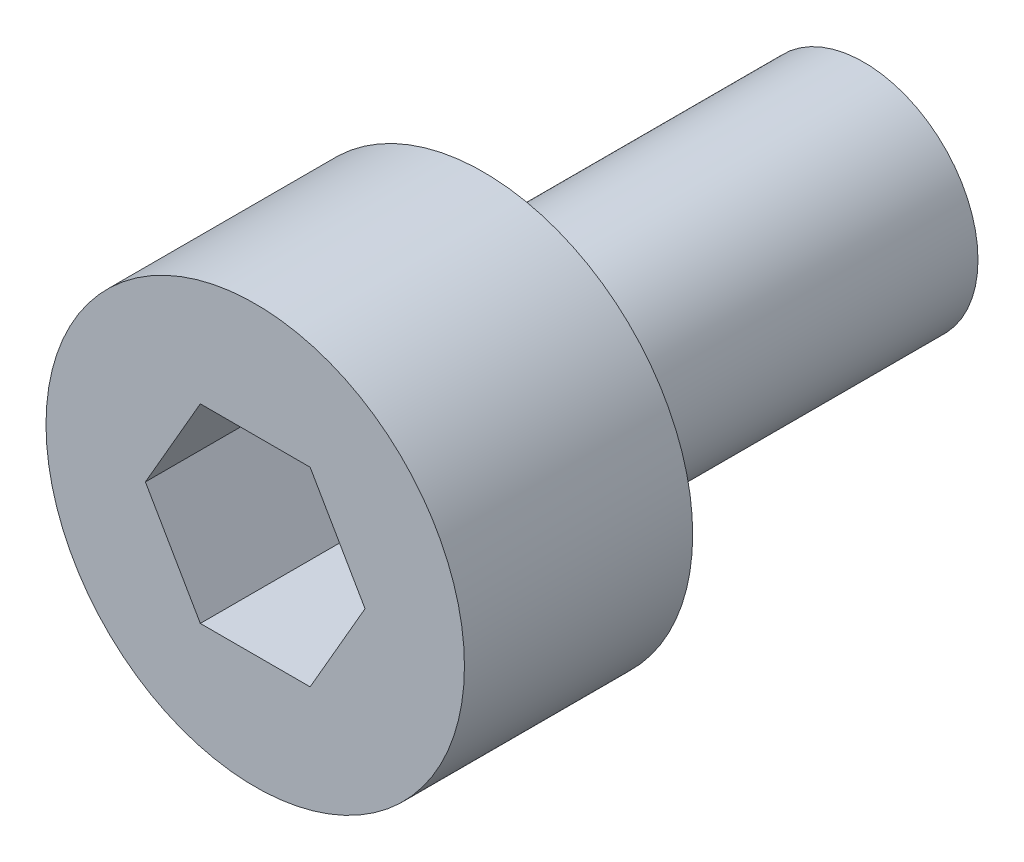
from build123d import *

# Parameters (mm, degrees)
ESQUISSE1_R             = 1.5
BOSS_EXTRU_1_DEPTH      = 5
ESQUISSE2_R             = 2.75
BOSS_EXTRU_2_DEPTH      = 3
ENL_V_MAT_EXTRU_1_DEPTH = 2


with BuildPart() as part:
    # Esquisse1 → Boss.-Extru.1 (new body)
    with BuildSketch(Plane.XY):
        Circle(ESQUISSE1_R)
    extrude(amount=BOSS_EXTRU_1_DEPTH)

    # Esquisse2 → Boss.-Extru.2 (add)
    with BuildSketch(Plane.XY.offset(5)):
        Circle(ESQUISSE2_R)
    extrude(amount=BOSS_EXTRU_2_DEPTH)

    # Esquisse3 → Enlèv. mat.-Extru.1 (cut)
    with BuildSketch(Plane.XY.offset(8)):
        Polygon((1.443375673, 0), (0.721687836, 1.25), (-0.721687836, 1.25), (-1.443375673, 0), (-0.721687836, -1.25), (0.721687836, -1.25), align=None)
    extrude(amount=-ENL_V_MAT_EXTRU_1_DEPTH, mode=Mode.SUBTRACT)


solid = part.part
